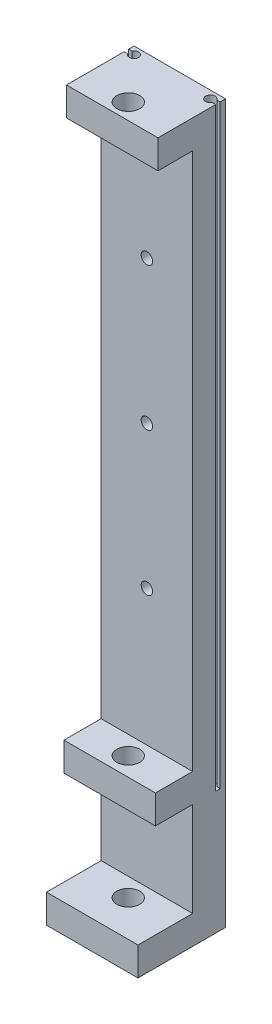
from build123d import *

# Parameters (mm, degrees)
SKETCH1_W               = 32
SKETCH1_H               = 30.6
BOSS_EXTRUDE1_DEPTH     = 10
SKETCH3_W               = 32
SKETCH3_H               = 23.6
BOSS_EXTRUDE2_DEPTH     = 10
SKETCH2_W               = 32
SKETCH2_H               = 11.5
BOSS_EXTRUDE3_DEPTH     = 231
SKETCH4_W               = 32
SKETCH4_H               = 13
BOSS_EXTRUDE4_DEPTH     = 10
CUT_EXTRUDE1_DEPTH      = 210.174783375
CUT_EXTRUDE1_DEPTH_BACK = 210.174783375
SKETCH5_R               = 4
SKETCH6_R               = 2
CUT_EXTRUDE2_DEPTH      = 11.5
CUT_EXTRUDE3_DEPTH      = 208


with BuildPart() as part:
    # Sketch1 → Boss-Extrude1 (new body)
    with BuildSketch(Plane(origin=(0, 0, 0), x_dir=(1, 0, 0), z_dir=(0, 1, 0))):
        Rectangle(SKETCH1_W, SKETCH1_H)
    extrude(amount=BOSS_EXTRUDE1_DEPTH)



with BuildPart() as body_2:
    # Sketch3 → Boss-Extrude2 (new body)
    with BuildSketch(Plane(origin=(0, 251, 0), x_dir=(-1, 0, 0), z_dir=(0, -1, 0))):
        with Locations((0, 3.5)):
            Rectangle(SKETCH3_W, SKETCH3_H)
    extrude(amount=BOSS_EXTRUDE2_DEPTH)


with BuildPart() as part_1:
    add(part.part)

    add(body_2.part)  # Boss-Extrude3 merges body 2
    # Sketch2 → Boss-Extrude3 (add)
    with BuildSketch(Plane(origin=(0, 10, 0), x_dir=(1, 0, 0), z_dir=(0, 1, 0))):
        with Locations((0, 9.55)):
            Rectangle(SKETCH2_W, SKETCH2_H)
    extrude(amount=BOSS_EXTRUDE3_DEPTH)

    # Sketch4 → Boss-Extrude4 (add)
    with BuildSketch(Plane(origin=(0, 53, 0), x_dir=(-1, 0, 0), z_dir=(0, -1, 0))):
        with Locations((0, -2.7)):
            Rectangle(SKETCH4_W, SKETCH4_H)
    extrude(amount=BOSS_EXTRUDE4_DEPTH)

    # Sketch5 → Cut-Extrude1 (cut, two sides: drawn at the far end of the back side and taken through both)
    with BuildSketch(Plane.XZ.offset(-43).offset(-CUT_EXTRUDE1_DEPTH_BACK)):
        with Locations(Location((0, 2.7, 0), (0, 0, 270))):
            Circle(SKETCH5_R)
    extrude(amount=CUT_EXTRUDE1_DEPTH + CUT_EXTRUDE1_DEPTH_BACK, mode=Mode.SUBTRACT)

    # Sketch6 → Cut-Extrude2 (cut)
    with BuildSketch(Plane(origin=(0, 0, -15.3), x_dir=(-1, 0, 0), z_dir=(0, 0, -1))):
        with Locations((0, 50.5)):
            Circle(SKETCH6_R)
        with Locations((0, 100.5)):
            Circle(SKETCH6_R)
        with Locations((0, 150.5)):
            Circle(SKETCH6_R)
        with Locations((0, 200.5)):
            Circle(SKETCH6_R)
    extrude(amount=-CUT_EXTRUDE2_DEPTH, mode=Mode.SUBTRACT)

    # Sketch7 → Cut-Extrude3 (cut)
    with BuildSketch(Plane(origin=(0, 251, 0), x_dir=(1, 0, 0), z_dir=(0, 1, 0))):
        with BuildLine():
            Line((-16, 11.85), (-16, 13.45))
            Line((-16, 13.45), (-14.793086969, 13.45))
            ThreePointArc((-14.793086969, 13.45), (-11.7, 12.65), (-14.793086969, 11.85))
            Line((-14.793086969, 11.85), (-16, 11.85))
        make_face()
        with BuildLine():
            Line((14.793086969, 13.45), (16, 13.45))
            Line((16, 13.45), (16, 11.85))
            Line((16, 11.85), (14.793086969, 11.85))
            ThreePointArc((14.793086969, 11.85), (11.7, 12.65), (14.793086969, 13.45))
        make_face()
    extrude(amount=-CUT_EXTRUDE3_DEPTH, mode=Mode.SUBTRACT)


solid = part_1.part
